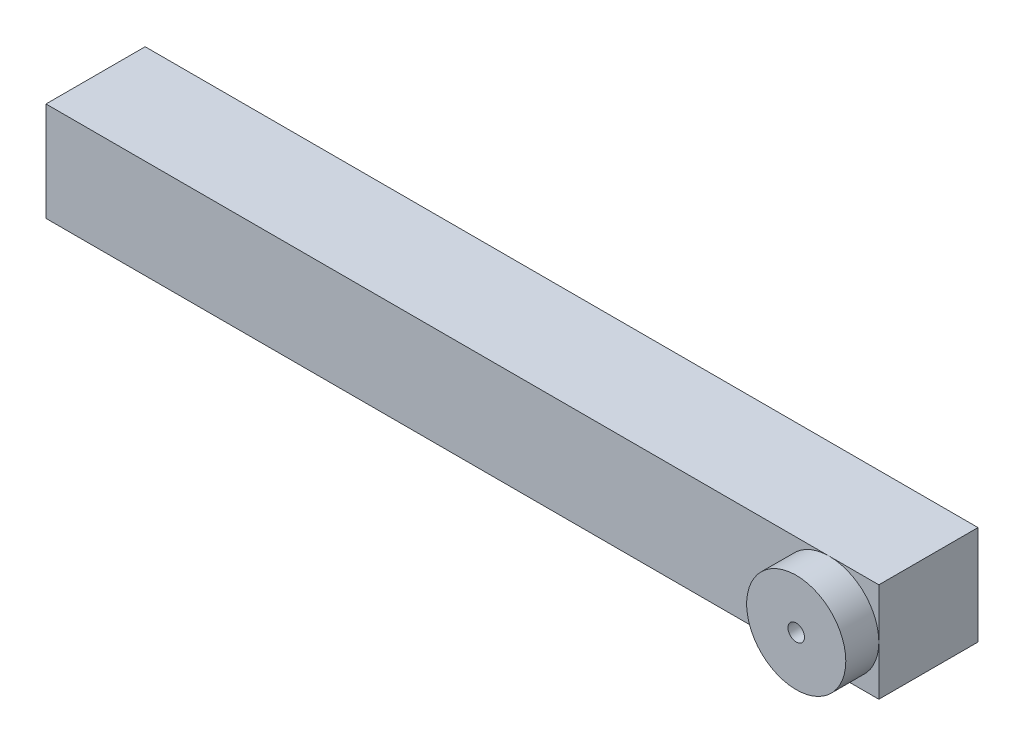
from build123d import *

# Parameters (mm, degrees)
SKETCH2_W           = 30
SKETCH2_H           = 30
BOSS_EXTRUDE1_DEPTH = 252
SKETCH3_R           = 15
BOSS_EXTRUDE2_DEPTH = 10
SKETCH4_R           = 2.5
CUT_EXTRUDE1_DEPTH  = 4


with BuildPart() as part:
    # Sketch2 → Boss-Extrude1 (new body)
    with BuildSketch(Plane(origin=(0, 0, 0), x_dir=(0, 0, -1), z_dir=(1, 0, 0))):
        with Locations((15, 15)):
            Rectangle(SKETCH2_W, SKETCH2_H)
    extrude(amount=BOSS_EXTRUDE1_DEPTH)

    # Sketch3 → Boss-Extrude2 (add)
    with BuildSketch(Plane.XY):
        with Locations((237, 15)):
            Circle(SKETCH3_R)
    extrude(amount=BOSS_EXTRUDE2_DEPTH)

    # Sketch4 → Cut-Extrude1 (cut)
    with BuildSketch(Plane.XY.offset(10)):
        with Locations((237, 15)):
            Circle(SKETCH4_R)
    extrude(amount=-CUT_EXTRUDE1_DEPTH, mode=Mode.SUBTRACT)


solid = part.part
